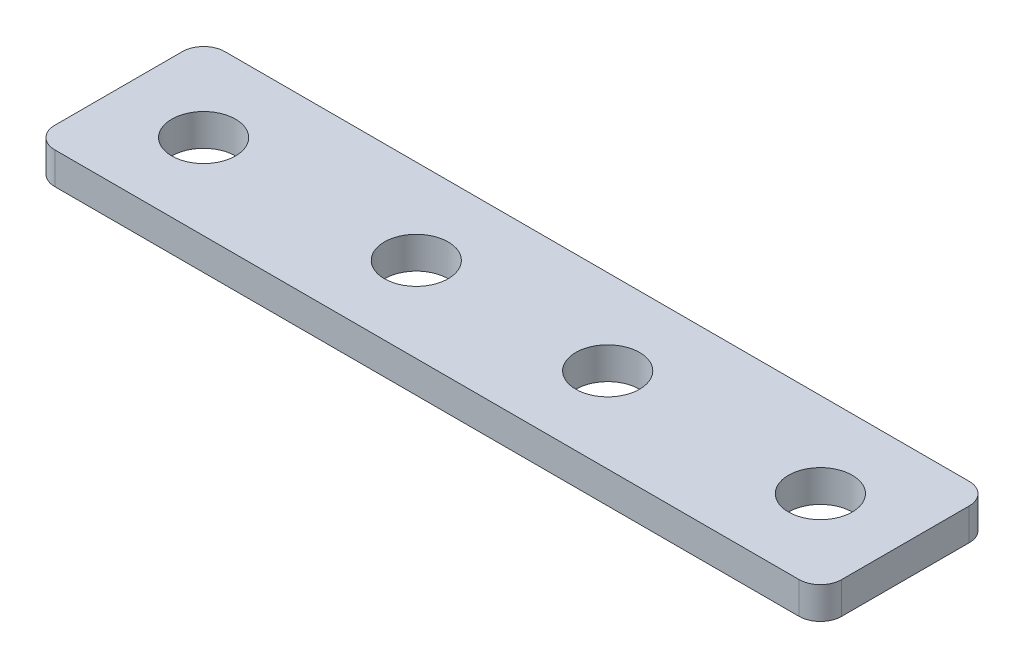
from build123d import *

# Parameters (mm, degrees)
BOSS_EXTRUDE1_DEPTH = 1.5
FILLET1_R           = 1


with BuildPart() as part:
    # Sketch1 → Boss-Extrude1 (new body)
    with BuildSketch(Plane(origin=(0, 0, 0), x_dir=(1, 0, 0), z_dir=(0, 1, 0))):
        with BuildLine():
            Line((18.5, 0), (18.5, 4))
            Line((18.5, 4), (15.5, 4))
            ThreePointArc((15.5, 4), (14, 2.5), (12.5, 4))
            Line((12.5, 4), (5.5, 4))
            ThreePointArc((5.5, 4), (4, 2.5), (2.5, 4))
            Line((2.5, 4), (0, 4))
            Line((0, 4), (0, 0))
            Line((0, 0), (18.5, 0))
        make_face()
        with BuildLine():
            Line((21.5, 4), (18.5, 4))
            Line((18.5, 4), (18.5, 0))
            Line((18.5, 0), (37, 0))
            Line((37, 0), (37, 4))
            Line((37, 4), (34.5, 4))
            ThreePointArc((34.5, 4), (33, 2.5), (31.5, 4))
            Line((31.5, 4), (24.5, 4))
            ThreePointArc((24.5, 4), (23, 2.5), (21.5, 4))
        make_face()
        with BuildLine():
            Line((18.5, 4), (18.5, 8))
            Line((18.5, 8), (0, 8))
            Line((0, 8), (0, 4))
            Line((0, 4), (2.5, 4))
            ThreePointArc((2.5, 4), (4, 5.5), (5.5, 4))
            Line((5.5, 4), (12.5, 4))
            ThreePointArc((12.5, 4), (14, 5.5), (15.5, 4))
            Line((15.5, 4), (18.5, 4))
        make_face()
        with BuildLine():
            Line((33, 8), (18.5, 8))
            Line((18.5, 8), (18.5, 4))
            Line((18.5, 4), (21.5, 4))
            ThreePointArc((21.5, 4), (23, 5.5), (24.5, 4))
            Line((24.5, 4), (31.5, 4))
            ThreePointArc((31.5, 4), (31.939339828, 5.060660172), (33, 5.5))
            Line((33, 5.5), (33, 8))
        make_face()
        with BuildLine():
            Line((37, 8), (33, 8))
            Line((33, 8), (33, 5.5))
            ThreePointArc((33, 5.5), (34.060660172, 5.060660172), (34.5, 4))
            Line((34.5, 4), (37, 4))
            Line((37, 4), (37, 8))
        make_face()
    extrude(amount=BOSS_EXTRUDE1_DEPTH)

    # Fillet1
    fillet1_edges = [part.edges().sort_by_distance(p)[0] for p in [
        (0, 0.75, 0),
        (0, 0.75, -8),
        (37, 0.75, -8),
        (37, 0.75, 0),
    ]]
    fillet(fillet1_edges, radius=FILLET1_R)


solid = part.part
